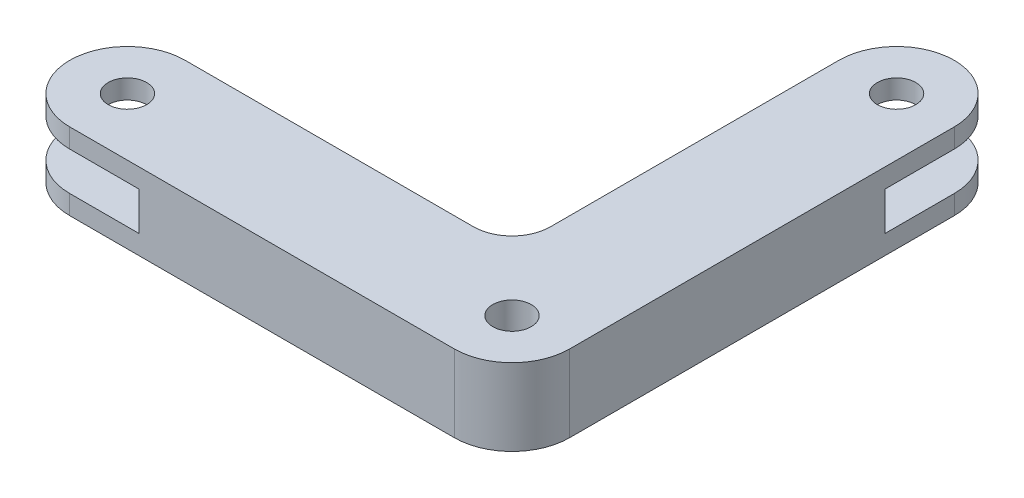
from build123d import *

# Parameters (mm, degrees)
SKETCH1_R               = 2.4
BOSS_EXTRUDE1_DEPTH     = 10
CUT_EXTRUDE1_DEPTH      = 2.5
CUT_EXTRUDE1_DEPTH_BACK = 2.5
SKETCH2_R               = 2.4
CUT_EXTRUDE2_DEPTH      = 2.5
CUT_EXTRUDE2_DEPTH_BACK = 2.5
SKETCH3_R               = 2.4
SCALE1_SCALE            = 0.8
SKETCH4_R               = 2
CUT_EXTRUDE3_DEPTH      = 69.982589006


with BuildPart() as part:
    # Sketch1 → Boss-Extrude1 (new body)
    with BuildSketch(Plane(origin=(0, 0, 0), x_dir=(1, 0, 0), z_dir=(0, 1, 0))):
        with BuildLine():
            Line((-50, 7.5), (-12.5, 7.5))
            ThreePointArc((-12.5, 7.5), (-8.964466094, 8.964466094), (-7.5, 12.5))
            Line((-7.5, 12.5), (-7.5, 50))
            ThreePointArc((-7.5, 50), (0, 57.5), (7.5, 50))
            Line((7.5, 50), (7.5, 0))
            ThreePointArc((7.5, 0), (5.303300859, -5.303300859), (0, -7.5))
            Line((0, -7.5), (-50, -7.5))
            ThreePointArc((-50, -7.5), (-57.5, 0), (-50, 7.5))
        make_face()
        with Locations(Location((0, 0, 0), (0, 0, 270))):
            Circle(SKETCH1_R, mode=Mode.SUBTRACT)
        with Locations(Location((-50, 0, 0), (0, 0, 270))):
            Circle(SKETCH1_R, mode=Mode.SUBTRACT)
        with Locations(Location((0, 50, 0), (0, 0, 270))):
            Circle(SKETCH1_R, mode=Mode.SUBTRACT)
    extrude(amount=BOSS_EXTRUDE1_DEPTH)

    # Sketch2 → Cut-Extrude1 (cut, two sides: drawn at the far end of the back side and taken through both)
    with BuildSketch(Plane(origin=(0, 5, 0), x_dir=(1, 0, 0), z_dir=(0, 1, 0)).offset(-CUT_EXTRUDE1_DEPTH_BACK)):
        with BuildLine():
            Line((-50, 7.5), (-41, 7.5))
            Line((-41, 7.5), (-41, -7.5))
            Line((-41, -7.5), (-50, -7.5))
            ThreePointArc((-50, -7.5), (-57.5, 0), (-50, 7.5))
        make_face()
        with Locations(Location((-50, 0, 0), (0, 0, 270))):
            Circle(SKETCH2_R, mode=Mode.SUBTRACT)
    extrude(amount=CUT_EXTRUDE1_DEPTH + CUT_EXTRUDE1_DEPTH_BACK, mode=Mode.SUBTRACT)

    # Sketch3 → Cut-Extrude2 (cut, two sides: drawn at the far end of the back side and taken through both)
    with BuildSketch(Plane(origin=(0, 5, 0), x_dir=(1, 0, 0), z_dir=(0, 1, 0)).offset(-CUT_EXTRUDE2_DEPTH_BACK)):
        with BuildLine():
            Line((-7.5, 50), (-7.5, 41))
            Line((-7.5, 41), (7.5, 41))
            Line((7.5, 41), (7.5, 50))
            ThreePointArc((7.5, 50), (0, 57.5), (-7.5, 50))
        make_face()
        with Locations(Location((0, 50, 0), (0, 0, 270))):
            Circle(SKETCH3_R, mode=Mode.SUBTRACT)
    extrude(amount=CUT_EXTRUDE2_DEPTH + CUT_EXTRUDE2_DEPTH_BACK, mode=Mode.SUBTRACT)


with BuildPart() as part_1:
    # Scale1: scaled about (-12.244648703, 5, -12.244648703)
    add(part.part.scale(SCALE1_SCALE).moved(Location((-2.448929741, 1, -2.448929741))))

    # Sketch4 → Cut-Extrude3 (cut, through all)
    with BuildSketch(Plane(origin=(0, 9, 0), x_dir=(1, 0, 0), z_dir=(0, 1, 0))):
        with Locations(Location((-2.448929741, 42.448929741, 0), (0, 0, 270))):
            Circle(SKETCH4_R)
        with Locations(Location((-2.448929741, 2.448929741, 0), (0, 0, 270))):
            Circle(SKETCH4_R)
        with Locations(Location((-42.448929741, 2.448929741, 0), (0, 0, 270))):
            Circle(SKETCH4_R)
    extrude(amount=-CUT_EXTRUDE3_DEPTH, mode=Mode.SUBTRACT)


solid = part_1.part
